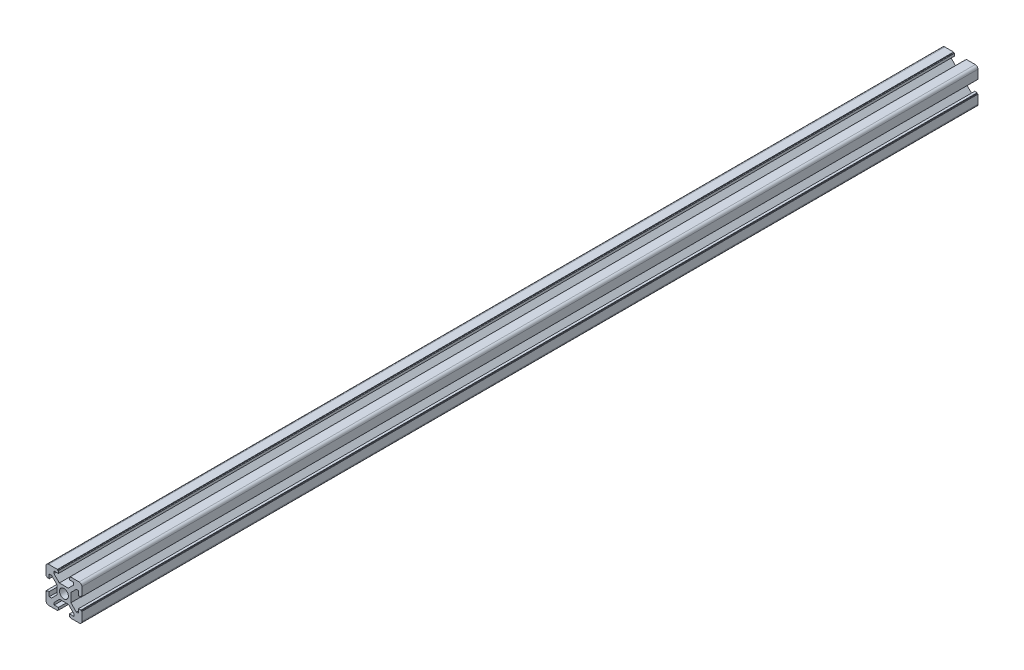
from build123d import *

# Parameters (mm, degrees)
SKETCH1_R           = 2.5
BOSS_EXTRUDE1_DEPTH = 500


with BuildPart() as part:
    # Sketch1 → Boss-Extrude1 (new body)
    with BuildSketch(Plane(origin=(0, 0, 0), x_dir=(-1, 0, 0), z_dir=(0, 0, -1))):
        with BuildLine():
            Line((-31.229112559, 24.389540696), (-31.229112559, 19.574084592))
            Line((-31.229112559, 19.574084592), (-30.801486653, 19.574084592))
            Line((-30.801486653, 19.574084592), (-30.801486653, 19.055371932))
            Line((-30.801486653, 19.055371932), (-29.429112559, 19.055371932))
            Line((-29.429112559, 19.055371932), (-29.429112559, 21.523527696))
            Line((-29.429112559, 21.523527696), (-28.141605593, 21.523527696))
            Line((-28.141605593, 21.523527696), (-25.129112559, 18.511034662))
            Line((-25.129112559, 18.511034662), (-25.129112559, 13.532983276))
            Line((-25.129112559, 13.532983276), (-28.141605593, 10.520490242))
            Line((-28.141605593, 10.520490242), (-29.429112559, 10.520490242))
            Line((-29.429112559, 10.520490242), (-29.429112559, 12.855371932))
            Line((-29.429112559, 12.855371932), (-30.801486653, 12.855371932))
            Line((-30.801486653, 12.855371932), (-30.801486653, 12.350696072))
            Line((-30.801486653, 12.350696072), (-31.229112559, 12.350696072))
            Line((-31.229112559, 12.350696072), (-31.229112559, 7.521203168))
            ThreePointArc((-31.229112559, 7.521203168), (-30.789772731, 6.460542996), (-29.729112559, 6.021203168))
            Line((-29.729112559, 6.021203168), (-24.847825219, 6.021203168))
            Line((-24.847825219, 6.021203168), (-24.847825219, 6.382997838))
            Line((-24.847825219, 6.382997838), (-24.329112559, 6.382997838))
            Line((-24.329112559, 6.382997838), (-24.329112559, 7.755371932))
            Line((-24.329112559, 7.755371932), (-26.797268323, 7.755371932))
            Line((-26.797268323, 7.755371932), (-26.797268323, 9.042878898))
            Line((-26.797268323, 9.042878898), (-23.784775289, 12.055371932))
            Line((-23.784775289, 12.055371932), (-18.806723903, 12.055371932))
            Line((-18.806723903, 12.055371932), (-15.794230869, 9.042878898))
            Line((-15.794230869, 9.042878898), (-15.794230869, 7.755371932))
            Line((-15.794230869, 7.755371932), (-18.129112559, 7.755371932))
            Line((-18.129112559, 7.755371932), (-18.129112559, 6.382997838))
            Line((-18.129112559, 6.382997838), (-17.624436699, 6.382997838))
            Line((-17.624436699, 6.382997838), (-17.624436699, 6.021203168))
            Line((-17.624436699, 6.021203168), (-12.729112559, 6.021203168))
            ThreePointArc((-12.729112559, 6.021203168), (-11.668452387, 6.460542996), (-11.229112559, 7.521203168))
            Line((-11.229112559, 7.521203168), (-11.229112559, 12.336659272))
            Line((-11.229112559, 12.336659272), (-11.656738465, 12.336659272))
            Line((-11.656738465, 12.336659272), (-11.656738465, 12.855371932))
            Line((-11.656738465, 12.855371932), (-13.029112559, 12.855371932))
            Line((-13.029112559, 12.855371932), (-13.029112559, 10.387216168))
            Line((-13.029112559, 10.387216168), (-14.316619525, 10.387216168))
            Line((-14.316619525, 10.387216168), (-17.329112559, 13.399709202))
            Line((-17.329112559, 13.399709202), (-17.329112559, 18.377760588))
            Line((-17.329112559, 18.377760588), (-14.316619525, 21.390253622))
            Line((-14.316619525, 21.390253622), (-13.029112559, 21.390253622))
            Line((-13.029112559, 21.390253622), (-13.029112559, 19.055371932))
            Line((-13.029112559, 19.055371932), (-11.656738465, 19.055371932))
            Line((-11.656738465, 19.055371932), (-11.656738465, 19.560047792))
            Line((-11.656738465, 19.560047792), (-11.229112559, 19.560047792))
            Line((-11.229112559, 19.560047792), (-11.229112559, 24.389540696))
            ThreePointArc((-11.229112559, 24.389540696), (-11.668452387, 25.450200868), (-12.729112559, 25.889540696))
            Line((-12.729112559, 25.889540696), (-17.610399899, 25.889540696))
            Line((-17.610399899, 25.889540696), (-17.610399899, 25.527746026))
            Line((-17.610399899, 25.527746026), (-18.129112559, 25.527746026))
            Line((-18.129112559, 25.527746026), (-18.129112559, 24.155371932))
            Line((-18.129112559, 24.155371932), (-15.660956795, 24.155371932))
            Line((-15.660956795, 24.155371932), (-15.660956795, 22.867864966))
            Line((-15.660956795, 22.867864966), (-18.673449829, 19.855371932))
            Line((-18.673449829, 19.855371932), (-23.651501215, 19.855371932))
            Line((-23.651501215, 19.855371932), (-26.663994249, 22.867864966))
            Line((-26.663994249, 22.867864966), (-26.663994249, 24.155371932))
            Line((-26.663994249, 24.155371932), (-24.329112559, 24.155371932))
            Line((-24.329112559, 24.155371932), (-24.329112559, 25.527746026))
            Line((-24.329112559, 25.527746026), (-24.833788419, 25.527746026))
            Line((-24.833788419, 25.527746026), (-24.833788419, 25.889540696))
            Line((-24.833788419, 25.889540696), (-29.729112559, 25.889540696))
            ThreePointArc((-29.729112559, 25.889540696), (-30.789772731, 25.450200868), (-31.229112559, 24.389540696))
        make_face()
        with Locations(Location((-21.229112559, 15.955371932, 0), (0, 0, 180))):
            Circle(SKETCH1_R, mode=Mode.SUBTRACT)
    extrude(amount=-BOSS_EXTRUDE1_DEPTH)


solid = part.part
